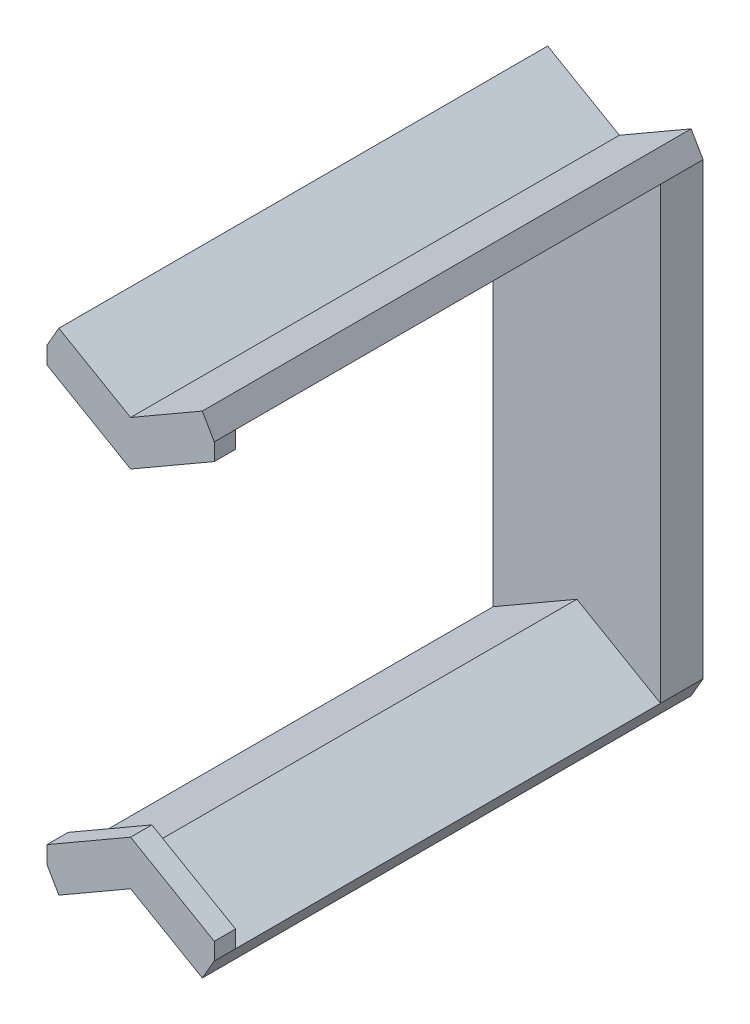
from build123d import *

# Parameters (mm, degrees)
BOSS_EXTRUDE1_DEPTH = 1
BOSS_EXTRUDE2_DEPTH = 11
BOSS_EXTRUDE4_DEPTH = 0.5


with BuildPart() as part:
    # Sketch1 → Boss-Extrude1 (new body)
    with BuildSketch(Plane.XY):
        Polygon((0, 4.801442841), (1.6875, 5.775721421), (1.96875, 5.288582131), (1.96875, -5.288582131), (1.6875, -5.775721421), (0, -4.801442841), (-1.6875, -5.775721421), (-1.96875, -5.288582131), (-1.96875, 5.288582131), (-1.6875, 5.775721421), align=None)
    extrude(amount=BOSS_EXTRUDE1_DEPTH)

    # Sketch2 → Boss-Extrude2 (add)
    with BuildSketch(Plane.XY):
        Polygon((0, -4.801442841), (0, -4.151923789), (-1.96875, -5.288582131), (-1.6875, -5.775721421), align=None)
        Polygon((1.96875, -5.288582131), (0, -4.151923789), (0, -4.801442841), (1.6875, -5.775721421), align=None)
        Polygon((-1.96875, 5.288582131), (0, 4.151923789), (0, 4.801442841), (-1.6875, 5.775721421), align=None)
        Polygon((0, 4.801442841), (0, 4.151923789), (1.96875, 5.288582131), (1.6875, 5.775721421), align=None)
    extrude(amount=BOSS_EXTRUDE2_DEPTH)

    # Sketch5 → Boss-Extrude4 (add)
    with BuildSketch(Plane.XY.offset(11)):
        Polygon((1.96875, -4.886658342), (0, -3.75), (0, -4.151923789), (1.96875, -5.288582131), align=None)
        Polygon((1.96875, -5.288582131), (0, -4.151923789), (0, -4.801442841), (1.6875, -5.775721421), align=None)
        Polygon((0, -4.801442841), (0, -4.151923789), (-1.96875, -5.288582131), (-1.6875, -5.775721421), align=None)
        Polygon((0, -4.151923789), (0, -3.75), (-1.96875, -4.886658342), (-1.96875, -5.288582131), align=None)
        Polygon((0, 4.801442841), (0, 4.151923789), (1.96875, 5.288582131), (1.6875, 5.775721421), align=None)
        Polygon((0, 4.151923789), (0, 3.75), (1.96875, 4.886658342), (1.96875, 5.288582131), align=None)
        Polygon((-1.96875, 5.288582131), (0, 4.151923789), (0, 4.801442841), (-1.6875, 5.775721421), align=None)
        Polygon((-1.96875, 4.886658342), (0, 3.75), (0, 4.151923789), (-1.96875, 5.288582131), align=None)
    extrude(amount=BOSS_EXTRUDE4_DEPTH)


solid = part.part
